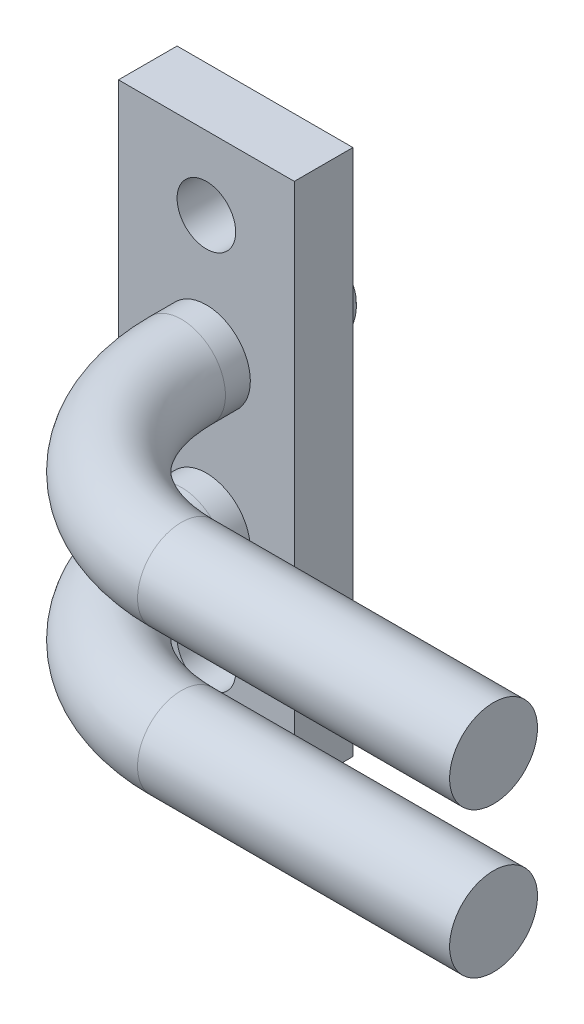
from build123d import *

# Parameters (mm, degrees)
SKETCH1_W           = 6
SKETCH1_H           = 18
BOSS_EXTRUDE1_DEPTH = 2
SKETCH2_R           = 1.5
BOSS_EXTRUDE2_DEPTH = 2.5
SKETCH6_W           = 2.684515713
SKETCH6_H           = 5.34346461
CUT_EXTRUDE2_DEPTH  = 10
FILLET1_R           = 1.5
SKETCH3_R           = 1.5
SKETCH5_R           = 1
CUT_EXTRUDE1_DEPTH  = 21.686831601


with BuildPart() as part:
    # Sketch1 → Boss-Extrude1 (new body)
    with BuildSketch(Plane.XY):
        Rectangle(SKETCH1_W, SKETCH1_H)
    extrude(amount=BOSS_EXTRUDE1_DEPTH)

    # Sketch2 → Boss-Extrude2 (add)
    with BuildSketch(Plane(origin=(0, 0, 0), x_dir=(-1, 0, 0), z_dir=(0, 0, -1))):
        with Locations((0, 2.35)):
            Circle(SKETCH2_R)
        with Locations((0, -2.62)):
            Circle(SKETCH2_R)
    extrude(amount=BOSS_EXTRUDE2_DEPTH)

    # Sketch6 → Cut-Extrude2 (cut)
    with BuildSketch(Plane.ZY.offset(3)):
        with Locations((-3.442257857, -3.208635448)):
            Rectangle(SKETCH6_W, SKETCH6_H)
    extrude(amount=-CUT_EXTRUDE2_DEPTH, mode=Mode.SUBTRACT)

    # Fillet1
    fillet1_edges = [part.edges().sort_by_distance(p)[0] for p in [
        (1.5, 2.35, -2.5),
        (1.5, -2.62, -2.1),
    ]]
    fillet(fillet1_edges, radius=FILLET1_R)

    # Sweep1: sweep along a path in Sketch4
    with BuildLine(Plane(origin=(0, 2.35, 0), x_dir=(-1, 0, 0), z_dir=(0, 1, 0))) as sweep1_path:
        Line((0, 2), (0, 2.85))
        ThreePointArc((0, 2.85), (-1.757359313, 7.092640687), (-6, 8.85))
        Line((-6, 8.85), (-16.65, 8.85))
    # Sketch3 → Sweep1 (sweep)
    with BuildSketch(Plane.XY.offset(2)):
        with Locations((0, -2.62)):
            Circle(SKETCH3_R)
        with Locations((0, 2.35)):
            Circle(SKETCH3_R)
    sweep(path=sweep1_path.line)

    # Sketch5 → Cut-Extrude1 (cut, through all)
    with BuildSketch(Plane.XY.offset(2)):
        with Locations((0, 6.5)):
            Circle(SKETCH5_R)
        with Locations(Location((0, -6.5, 0), (0, 0, 180))):
            Circle(SKETCH5_R)
    extrude(amount=-CUT_EXTRUDE1_DEPTH, mode=Mode.SUBTRACT)


solid = part.part
